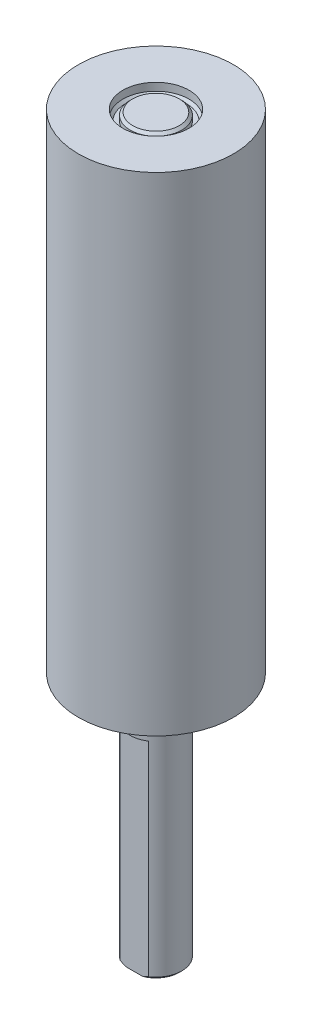
from build123d import *

# Parameters (mm, degrees)
CROQUIS1_W                          = 7.5
CROQUIS1_H                          = 47.25
CROQUIS2_R                          = 3.2
SALIENTE_EXTRUIR1_DEPTH             = 1
CROQUIS3_R                          = 2.5
SALIENTE_EXTRUIR2_DEPTH             = 23
CORTAR_EXTRUIR1_START               = -20
CORTAR_EXTRUIR1_DEPTH               = 20
DI_METRO_DE_TALADRO_6_4_6_4_1_D     = 6.4
DI_METRO_DE_TALADRO_6_4_6_4_1_DEPTH = 1
CROQUIS7_W                          = 2.5
CROQUIS7_H                          = 0.75
CHAFL_N1_SIZE                       = 0.25


with BuildPart() as part:
    # Croquis1 → Revolución1 (revolve)
    with BuildSketch(Plane(origin=(0, 0, 0), x_dir=(-1, 0, 0), z_dir=(0, 0, -1)), mode=Mode.PRIVATE) as revoluci_n1_sk:
        with Locations((-3.75, 15.625)):
            Rectangle(CROQUIS1_W, CROQUIS1_H)
    revolve(revoluci_n1_sk.sketch.rotate(Axis((0, -8, 0), (0, 1, 0)), 270), axis=Axis((0, -8, 0), (0, 1, 0)))

    # Croquis2 → Saliente-Extruir1 (add)
    with BuildSketch(Plane.XZ.offset(8)):
        with Locations(Location((0, 0, 0), (0, 0, 270))):
            Circle(CROQUIS2_R)
    extrude(amount=SALIENTE_EXTRUIR1_DEPTH)

    # Croquis3 → Saliente-Extruir2 (add)
    with BuildSketch(Plane.XZ.offset(9)):
        with Locations(Location((0, 0, 0), (0, 0, 270))):
            Circle(CROQUIS3_R)
    extrude(amount=SALIENTE_EXTRUIR2_DEPTH)

    # Croquis4 → Cortar-Extruir1 (cut)
    with BuildSketch(Plane.XZ.offset(32).offset(CORTAR_EXTRUIR1_START)):
        with BuildLine():
            Line((-1.356465997, 2.1), (1.356465997, 2.1))
            ThreePointArc((1.356465997, 2.1), (0, 2.5), (-1.356465997, 2.1))
        make_face()
    extrude(amount=CORTAR_EXTRUIR1_DEPTH, mode=Mode.SUBTRACT)

    # Diámetro de taladro Ø6.4 (6.4)1
    with Locations(Plane(origin=(0, 39.25, 0), x_dir=(1, 0, 0), z_dir=(0, 1, 0))):
        with Locations((0, 0)):
            Hole(DI_METRO_DE_TALADRO_6_4_6_4_1_D / 2, depth=DI_METRO_DE_TALADRO_6_4_6_4_1_DEPTH)

    # Croquis7 → Revolución2 (revolve)
    with BuildSketch(Plane(origin=(0, 0, 0), x_dir=(-1, 0, 0), z_dir=(0, 0, -1)), mode=Mode.PRIVATE) as revoluci_n2_sk:
        with Locations((-1.25, 38.625)):
            Rectangle(CROQUIS7_W, CROQUIS7_H)
    revolve(revoluci_n2_sk.sketch.rotate(Axis((0, 38.25, 0), (0, 1, 0)), 270), axis=Axis((0, 38.25, 0), (0, 1, 0)))

    # Chaflán1
    chafl_n1_edges = [part.edges().sort_by_distance(p)[0] for p in [
        (0, -9, 3.2),
        (-2.397915762, -32, -0.707106781),
        (3.2, 38.25, 0),
        (0, 39, -2.5),
    ]]
    chamfer(chafl_n1_edges, length=CHAFL_N1_SIZE)


solid = part.part
